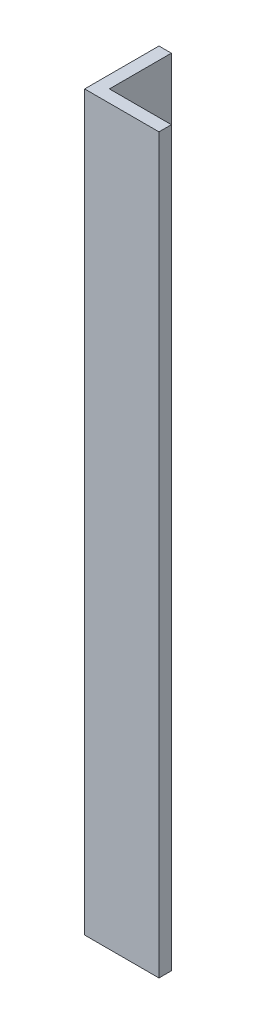
from build123d import *

# Parameters (mm, degrees)
SALIENTE_EXTRUIR1_DEPTH = 93.901290125


with BuildPart() as part:
    # Croquis1 → Saliente-Extruir1 (new, symmetric)
    with BuildSketch(Plane(origin=(0, 0, 0), x_dir=(1, 0, 0), z_dir=(0, 1, 0))):
        Polygon((0, 0), (19.05, 0), (19.05, 3.175), (3.175, 3.175), (3.175, 19.05), (0, 19.05), align=None)
    extrude(amount=SALIENTE_EXTRUIR1_DEPTH, both=True)


solid = part.part
